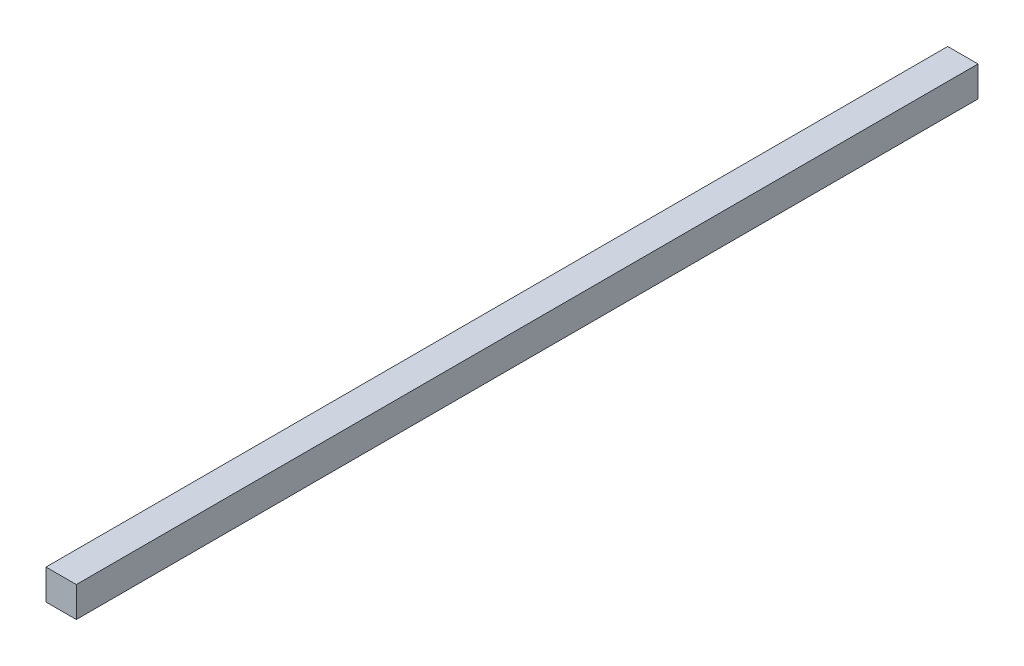
from build123d import *

# Parameters (mm, degrees)
SKETCH1_W           = 20
SKETCH1_H           = 20
BOSS_EXTRUDE1_DEPTH = 595


with BuildPart() as part:
    # Sketch1 → Boss-Extrude1 (new body)
    with BuildSketch(Plane.XY):
        Rectangle(SKETCH1_W, SKETCH1_H)
    extrude(amount=BOSS_EXTRUDE1_DEPTH)


solid = part.part
